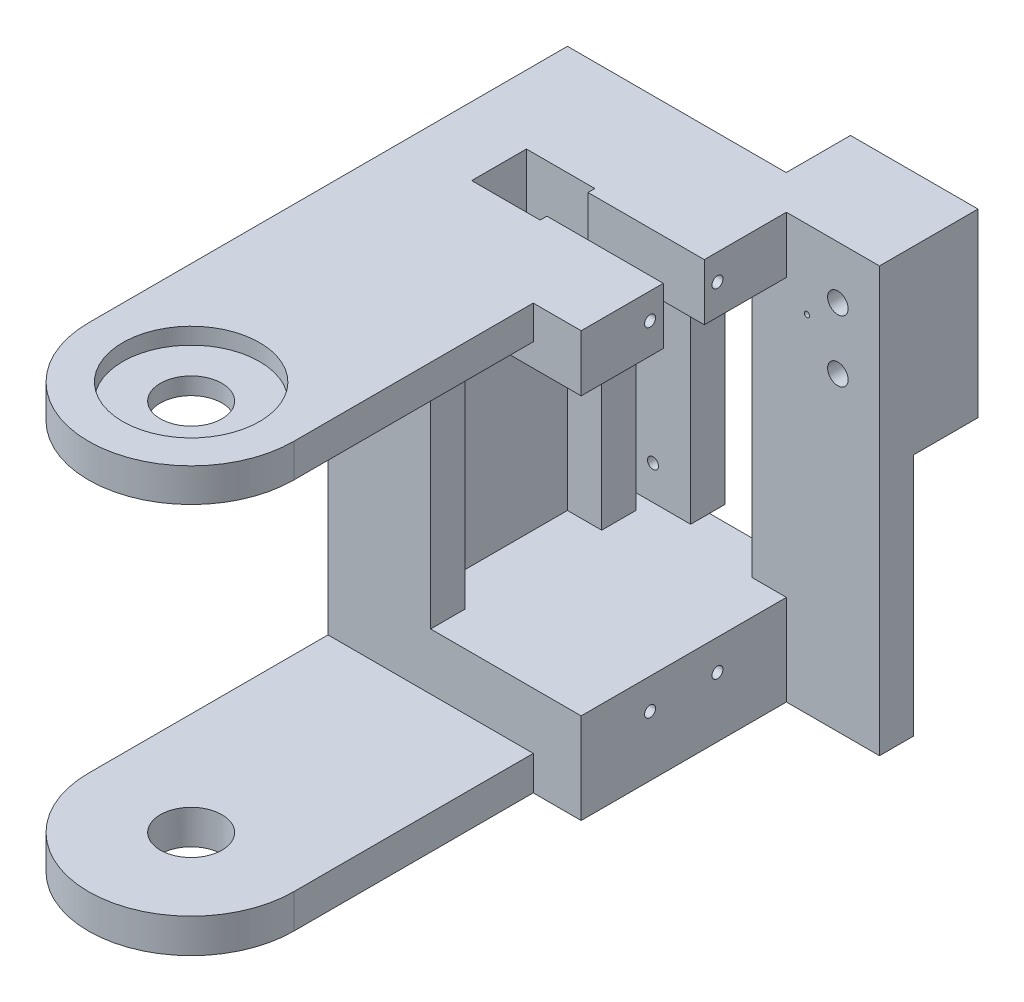
from build123d import *

# Parameters (mm, degrees)
ESQUISSE1_W                 = 60.5
ESQUISSE1_H                 = 64
BOSS_EXTRU_1_DEPTH          = 30
ESQUISSE2_R                 = 4.5
ENL_V_MAT_EXTRU_1_DEPTH     = 32
ENL_V_MAT_EXTRU_2_REACH     = 55.283
ESQUISSE4_W                 = 51.1
ESQUISSE4_H                 = 83.557669167
ESQUISSE5_R                 = 10.5
ENL_V_MAT_EXTRU_3_DEPTH     = 2
ESQUISSE6_R                 = 10
ENL_V_MAT_EXTRU_4_DEPTH     = 4.7
ESQUISSE7_W                 = 47
ESQUISSE7_H                 = 57
BOSS_EXTRU_2_DEPTH          = 30
ENL_V_MAT_EXTRU_5_DEPTH     = 30
ENL_V_MAT_EXTRU_6_DEPTH     = 8.25
ESQUISSE11_W                = 5
ESQUISSE11_H                = 40.5
BOSS_EXTRU_3_DEPTH          = 5
ESQUISSE12_R                = 0.5
ENL_V_MAT_EXTRU_7_DEPTH     = 15
TROU_TARAUD_M2X0_42_D       = 1.6
TROU_TARAUD_M2X0_42_DEPTH   = 17
TROU_TARAUD_M2X0_42_TIP     = 0.480688495
ENL_V_MAT_EXTRU_8_REACH     = 113.72
ESQUISSE22_W                = 82.97203866
ESQUISSE22_H                = 67.875780224
ENL_V_MAT_EXTRU_10_DEPTH    = 30
ESQUISSE23_W                = 55
ESQUISSE23_H                = 5
ESQUISSE23_H_2              = 4.9
BOSS_EXTRU_4_DEPTH          = 30
ENL_V_START                 = -62
ESQUISSE24_R                = 10
ENL_V_MAT_EXTRU_11_DEPTH    = 62
ENL_V_MAT_EXTRU_12_REACH    = 111.597
ESQUISSE26_R                = 10.5
ESQUISSE26_R_2              = 4.5
BOSS_EXTRU_5_DEPTH          = 5
ESQUISSE27_R                = 10.5
ENL_V_MAT_EXTRU_13_DEPTH    = 2.5
ESQUISSE28_W                = 21.53784572
ESQUISSE28_H                = 33.22443827
ENL_V_MAT_EXTRU_14_DEPTH    = 5
ESQUISSE29_W                = 5
ESQUISSE29_H                = 52.1
ENL_V_MAT_EXTRU_15_DEPTH    = 30
BOSS_EXTRU_6_DEPTH          = 62
ENL_V_START_2               = -20.388398
ESQUISSE32_W                = 38.789198293
ESQUISSE32_H                = 52.1
ENL_V_MAT_EXTRU_16_DEPTH    = 20.388398
ESQUISSE36_W                = 70.879809572
ESQUISSE36_H                = 44.299384872
ENL_V_MAT_EXTRU_20_DEPTH    = 62
ESQUISSE37_W                = 30
ESQUISSE37_H                = 4.9
ESQUISSE37_H_2              = 5
BOSS_EXTRU_8_DEPTH          = 50
ESQUISSE38_R                = 4.5
ENL_V_MAT_EXTRU_21_DEPTH    = 62
ESQUISSE39_R                = 10
ENL_V_MAT_EXTRU_22_DEPTH    = 4.9
ESQUISSE40_R                = 10.5
ENL_V_MAT_EXTRU_23_DEPTH    = 2.5
ENL_V_MAT_EXTRU_24_REACH    = 104.013
ESQUISSE44_W                = 30
ESQUISSE44_H                = 4.9
ESQUISSE44_H_2              = 5
BOSS_EXTRU_9_DEPTH          = 50
ENL_V_MAT_EXTRU_25_REACH    = 127.904
ESQUISSE45_R                = 4.5
ESQUISSE46_R                = 10
ENL_V_MAT_EXTRU_26_DEPTH    = 4.9
ESQUISSE47_R                = 10.5
ENL_V_MAT_EXTRU_27_DEPTH    = 2.5
ENL_V_MAT_EXTRU_28_DEPTH    = 62
ESQUISSE49_W                = 23
ESQUISSE49_H                = 31
BOSS_EXTRU_10_DEPTH         = 5
ESQUISSE50_R                = 0.45
ENL_V_MAT_EXTRU_29_DEPTH    = 5
TROU_TARAUD_M2X0_43_D       = 1.6
TROU_TARAUD_M2X0_43_DEPTH   = 10
TROU_TARAUD_M2X0_43_TIP     = 0.480688495
BOSS_EXTRU_11_DEPTH         = 5
ESQUISSE53_R                = 10.5
ESQUISSE53_R_2              = 4.5
BOSS_EXTRU_12_DEPTH         = 2.5
BOSS_EXTRU_14_START         = -2.5
ESQUISSE55_R                = 10
ESQUISSE55_R_2              = 4.5
BOSS_EXTRU_14_DEPTH         = 2.5
ESQUISSE56_R                = 0.3
ESQUISSE56_R_2              = 1.5
ENL_V_MAT_EXTRU_30_DEPTH    = 5
ESQUISSE58_W                = 13.11360463
ESQUISSE58_H                = 66.02814963
ENL_V_MAT_EXTRU_31_DEPTH    = 0.4
ESQUISSE59_W                = 19.635648438
ESQUISSE59_H                = 26.411381916
ESQUISSE59_R                = 0.3
ESQUISSE59_R_2              = 1.5
BOSS_EXTRU_15_DEPTH         = 9.4
TROU_TARAUD_M1_4X0_31_D     = 1.1
TROU_TARAUD_M1_4X0_31_DEPTH = 14.3
TROU_TARAUD_M1_4X0_31_TIP   = 0.33047334
ESQUISSE63_W                = 17.246623056
ESQUISSE63_H                = 70.264019857
ENL_V_MAT_EXTRU_32_DEPTH    = 1


with BuildPart() as part:
    # Esquisse1 → Boss.-Extru.1 (new body)
    with BuildSketch(Plane.XY):
        Rectangle(ESQUISSE1_W, ESQUISSE1_H)
    extrude(amount=BOSS_EXTRU_1_DEPTH)

    # Esquisse2 → Enlèv. mat.-Extru.1 (cut)
    with BuildSketch(Plane(origin=(30.25, 0, 0), x_dir=(0, 0, -1), z_dir=(1, 0, 0))):
        with Locations(Location((-15, -17, 0), (0, 0, 90))):
            Circle(ESQUISSE2_R)
    extrude(amount=-ENL_V_MAT_EXTRU_1_DEPTH, mode=Mode.SUBTRACT)

    # Enlèv. mat.-Extru.2: up to this face of the body (flat: up to its plane)
    enl_v_mat_extru_2_end = Plane(part.part.faces().sort_by_distance((0, 0, 0))[0])
    # Esquisse4 → Enlèv. mat.-Extru.2 (cut, up to the picked face)
    with BuildSketch(Plane.XY.offset(30), mode=Mode.PRIVATE) as enl_v_mat_extru_2_sk1:
        with Locations((0, -14.778834584)):
            Rectangle(ESQUISSE4_W, ESQUISSE4_H)
    enl_v_mat_extru_2_tool1 = split(extrude(enl_v_mat_extru_2_sk1.sketch, amount=-ENL_V_MAT_EXTRU_2_REACH, mode=Mode.PRIVATE), bisect_by=enl_v_mat_extru_2_end, keep=Keep.BOTH, mode=Mode.PRIVATE)
    add(enl_v_mat_extru_2_tool1.solids().sort_by(Axis((0, -14.778835, 30), (0, 0, -1)))[0], mode=Mode.SUBTRACT)

    # Esquisse5 → Enlèv. mat.-Extru.3 (cut)
    with BuildSketch(Plane(origin=(30.25, 0, 0), x_dir=(0, 0, -1), z_dir=(1, 0, 0))):
        with Locations(Location((-15, -17, 0), (0, 0, 90))):
            Circle(ESQUISSE5_R)
    extrude(amount=-ENL_V_MAT_EXTRU_3_DEPTH, mode=Mode.SUBTRACT)

    # Esquisse6 → Enlèv. mat.-Extru.4 (cut)
    with BuildSketch(Plane(origin=(-25.55, 0, 0), x_dir=(0, 0, -1), z_dir=(1, 0, 0))):
        with Locations((-15, -17)):
            Circle(ESQUISSE6_R)
    extrude(amount=-ENL_V_MAT_EXTRU_4_DEPTH, mode=Mode.SUBTRACT)

    # Esquisse7 → Boss.-Extru.2 (add)
    with BuildSketch(Plane.XY.offset(30)):
        with Locations((-6.75, 60.5)):
            Rectangle(ESQUISSE7_W, ESQUISSE7_H)
    extrude(amount=-BOSS_EXTRU_2_DEPTH)

    # Esquisse8 → Enlèv. mat.-Extru.5 (cut)
    with BuildSketch(Plane.XY.offset(30)):
        Polygon((-15.25, 80.75), (11.75, 80.75), (11.75, 101.149817475), (21.75, 101.149817475), (21.75, 32), (11.75, 32), (11.75, 40.25), (-15.25, 40.25), align=None)
    extrude(amount=-ENL_V_MAT_EXTRU_5_DEPTH, mode=Mode.SUBTRACT)

    # Esquisse10 → Enlèv. mat.-Extru.6 (cut)
    with BuildSketch(Plane.XZ.offset(-80.75)):
        Polygon((-5.25, 11), (-5.25, 12), (34.75, 12), (34.75, 18), (-5.25, 18), (-5.25, 19), (-15.25, 19), (-15.25, 11), align=None)
    extrude(amount=-ENL_V_MAT_EXTRU_6_DEPTH, mode=Mode.SUBTRACT)

    # Esquisse11 → Boss.-Extru.3 (add)
    with BuildSketch(Plane(origin=(-15.25, 0, 0), x_dir=(0, 0, -1), z_dir=(1, 0, 0))):
        with Locations((-27.5, 60.5)):
            Rectangle(ESQUISSE11_W, ESQUISSE11_H)
        with Locations((-2.5, 60.5)):
            Rectangle(ESQUISSE11_W, ESQUISSE11_H)
    extrude(amount=BOSS_EXTRU_3_DEPTH)

    # Esquisse12 → Enlèv. mat.-Extru.7 (cut)
    with BuildSketch(Plane(origin=(11.75, 0, 0), x_dir=(0, 0, -1), z_dir=(1, 0, 0))):
        with Locations((-19.925, 85.21)):
            Circle(ESQUISSE12_R)
        with Locations(Location((-10.075, 85.21, 0), (0, 0, 180))):
            Circle(ESQUISSE12_R)
        with Locations((-10.075, 35.79)):
            Circle(ESQUISSE12_R)
        with Locations(Location((-19.925, 35.79, 0), (0, 0, 180))):
            Circle(ESQUISSE12_R)
    extrude(amount=-ENL_V_MAT_EXTRU_7_DEPTH, mode=Mode.SUBTRACT)

    # Trou taraudé M2x0.42
    with Locations(Plane(origin=(11.75, 85.21, 19.925), x_dir=(0, 0, 1), z_dir=(1, 0, 0))):
        with Locations((0, 0), (-9.85, 0), (-9.85, 49.42), (0, 49.42)):
            Hole(TROU_TARAUD_M2X0_42_D / 2, depth=TROU_TARAUD_M2X0_42_DEPTH)
            with Locations((0, 0, -(TROU_TARAUD_M2X0_42_DEPTH + TROU_TARAUD_M2X0_42_TIP / 2))):  # 118° drill point
                Cone(0, TROU_TARAUD_M2X0_42_D / 2, TROU_TARAUD_M2X0_42_TIP, mode=Mode.SUBTRACT)

    # Enlèv. mat.-Extru.8: up to this face of the body (flat: up to its plane)
    enl_v_mat_extru_8_end = Plane(part.part.faces().sort_by_distance((30.25, 3.741727612, 15))[0])
    # Esquisse15 → Enlèv. mat.-Extru.8 (cut, up to the picked face)
    with BuildSketch(Plane.ZY.offset(30.25), mode=Mode.PRIVATE) as enl_v_mat_extru_8_sk1:
        with BuildLine():
            Line((40, -17), (30, -17))
            ThreePointArc((30, -17), (15, -32), (0, -17))
            Line((0, -17), (-10, -17))
            ThreePointArc((-10, -17), (15, -42), (40, -17))
        make_face()
    enl_v_mat_extru_8_tool1 = split(extrude(enl_v_mat_extru_8_sk1.sketch, amount=-ENL_V_MAT_EXTRU_8_REACH, mode=Mode.PRIVATE), bisect_by=enl_v_mat_extru_8_end, keep=Keep.BOTH, mode=Mode.PRIVATE)
    add(enl_v_mat_extru_8_tool1.solids().sort_by(Axis((-30.25, -17.559017, -5), (1, 0, 0)))[0], mode=Mode.SUBTRACT)

    # Esquisse22 → Enlèv. mat.-Extru.10 (cut)
    with BuildSketch(Plane.XY.offset(30)):
        with Locations((-1.917421061, -6.937890112)):
            Rectangle(ESQUISSE22_W, ESQUISSE22_H)
    extrude(amount=-ENL_V_MAT_EXTRU_10_DEPTH, mode=Mode.SUBTRACT)

    # Esquisse23 → Boss.-Extru.4 (add)
    with BuildSketch(Plane(origin=(0, 0, 0), x_dir=(-1, 0, 0), z_dir=(0, 0, -1))):
        with Locations((57.75, 29.5)):
            Rectangle(ESQUISSE23_W, ESQUISSE23_H)
        with Locations((57.75, 86.55)):
            Rectangle(ESQUISSE23_W, ESQUISSE23_H_2)
    extrude(amount=-BOSS_EXTRU_4_DEPTH)

    # Esquisse24 → Enlèv. mat.-Extru.11 (cut)
    with BuildSketch(Plane.XZ.offset(-27).offset(ENL_V_START)):
        with Locations((-74.25, 15)):
            Circle(ESQUISSE24_R)
    extrude(amount=ENL_V_MAT_EXTRU_11_DEPTH, mode=Mode.SUBTRACT)

    # Enlèv. mat.-Extru.12: up to this face of the body (flat: up to its plane)
    enl_v_mat_extru_12_end = Plane(part.part.faces().sort_by_distance((-34.437928466, 89, 15))[0])
    # Esquisse25 → Enlèv. mat.-Extru.12 (cut, up to the picked face)
    with BuildSketch(Plane.XZ.offset(-27), mode=Mode.PRIVATE) as enl_v_mat_extru_12_sk1:
        with BuildLine():
            Line((-74.25, 44.134833893), (-74.25, 30))
            ThreePointArc((-74.25, 30), (-89.25, 15), (-74.25, 0))
            Line((-74.25, 0), (-74.25, -14.134833893))
            ThreePointArc((-74.25, -14.134833893), (-103.384833893, 15), (-74.25, 44.134833893))
        make_face()
    enl_v_mat_extru_12_tool1 = split(extrude(enl_v_mat_extru_12_sk1.sketch, amount=-ENL_V_MAT_EXTRU_12_REACH, mode=Mode.PRIVATE), bisect_by=enl_v_mat_extru_12_end, keep=Keep.BOTH, mode=Mode.PRIVATE)
    add(enl_v_mat_extru_12_tool1.solids().sort_by(Axis((-74.901475, 27, 37.067417), (0, 1, 0)))[0], mode=Mode.SUBTRACT)

    # Esquisse26 → Boss.-Extru.5 (add)
    with BuildSketch(Plane.XZ.offset(-27)):
        with Locations((-74.25, 15)):
            Circle(ESQUISSE26_R)
        with Locations((-74.25, 15)):
            Circle(ESQUISSE26_R_2, mode=Mode.SUBTRACT)
    extrude(amount=-BOSS_EXTRU_5_DEPTH)

    # Esquisse27 → Enlèv. mat.-Extru.13 (cut)
    with BuildSketch(Plane.XZ.offset(-27)):
        with Locations((-74.25, 15)):
            Circle(ESQUISSE27_R)
    extrude(amount=-ENL_V_MAT_EXTRU_13_DEPTH, mode=Mode.SUBTRACT)

    # Esquisse28 → Enlèv. mat.-Extru.14 (cut)
    with BuildSketch(Plane(origin=(0, 32, 0), x_dir=(1, 0, 0), z_dir=(0, 1, 0))):
        with Locations((22.51892286, -16.612219135)):
            Rectangle(ESQUISSE28_W, ESQUISSE28_H)
    extrude(amount=-ENL_V_MAT_EXTRU_14_DEPTH, mode=Mode.SUBTRACT)

    # Esquisse29 → Enlèv. mat.-Extru.15 (cut)
    with BuildSketch(Plane(origin=(0, 0, 0), x_dir=(-1, 0, 0), z_dir=(0, 0, -1))):
        with Locations((27.75, 58.05)):
            Rectangle(ESQUISSE29_W, ESQUISSE29_H)
    extrude(amount=-ENL_V_MAT_EXTRU_15_DEPTH, mode=Mode.SUBTRACT)

    # Esquisse31 → Boss.-Extru.6 (add)
    with BuildSketch(Plane.XZ.offset(-27)):
        with BuildLine():
            ThreePointArc((-74.826036871, 4.515812787), (-83.84709586, 10.740217019), (-82.411654216, 21.605861069))
            Line((-82.411654216, 21.605861069), (-85.25, 25.198039027))
            Line((-85.25, 25.198039027), (-85.25, 4.801960973))
            Line((-85.25, 4.801960973), (-74.826036871, 4.515812787))
        make_face()
        with BuildLine():
            ThreePointArc((-85.25, 25.198039027), (-89.25, 15), (-85.25, 4.801960973))
            Line((-85.25, 4.801960973), (-85.25, 25.198039027))
        make_face()
    extrude(amount=-BOSS_EXTRU_6_DEPTH)

    # Esquisse32 → Enlèv. mat.-Extru.16 (cut)
    with BuildSketch(Plane(origin=(0.067526976, 0, 2.459909751), x_dir=(-0.9996234341769173, 0, 0.027440660421105302), z_dir=(-0.027440660421105302, 0, -0.9996234341769173)).offset(ENL_V_START_2)):
        with Locations((94.316375975, 58.05)):
            Rectangle(ESQUISSE32_W, ESQUISSE32_H)
    extrude(amount=ENL_V_MAT_EXTRU_16_DEPTH, mode=Mode.SUBTRACT)

    # Esquisse36 → Enlèv. mat.-Extru.20 (cut)
    with BuildSketch(Plane.XZ.offset(-27)):
        with Locations((-60.689904786, 17.333529037)):
            Rectangle(ESQUISSE36_W, ESQUISSE36_H)
    extrude(amount=-ENL_V_MAT_EXTRU_20_DEPTH, mode=Mode.SUBTRACT)

    # Esquisse37 → Boss.-Extru.8 (add)
    with BuildSketch(Plane.ZY.offset(25.25)):
        with Locations((15, 86.55)):
            Rectangle(ESQUISSE37_W, ESQUISSE37_H)
        with Locations((15, 29.5)):
            Rectangle(ESQUISSE37_W, ESQUISSE37_H_2)
    extrude(amount=BOSS_EXTRU_8_DEPTH)

    # Esquisse38 → Enlèv. mat.-Extru.21 (cut)
    with BuildSketch(Plane.XZ.offset(-27).offset(ENL_V_START)):
        with Locations((-59.885466485, 15)):
            Circle(ESQUISSE38_R)
    extrude(amount=ENL_V_MAT_EXTRU_21_DEPTH, mode=Mode.SUBTRACT)

    # Esquisse39 → Enlèv. mat.-Extru.22 (cut)
    with BuildSketch(Plane(origin=(0, 89, 0), x_dir=(1, 0, 0), z_dir=(0, 1, 0))):
        with Locations(Location((-59.885466485, -15, 0), (0, 0, 270))):
            Circle(ESQUISSE39_R)
    extrude(amount=-ENL_V_MAT_EXTRU_22_DEPTH, mode=Mode.SUBTRACT)

    # Esquisse40 → Enlèv. mat.-Extru.23 (cut)
    with BuildSketch(Plane.XZ.offset(-27)):
        with Locations((-59.885466485, 15)):
            Circle(ESQUISSE40_R)
    extrude(amount=-ENL_V_MAT_EXTRU_23_DEPTH, mode=Mode.SUBTRACT)

    # Enlèv. mat.-Extru.24: up to this face of the body (flat: up to its plane)
    enl_v_mat_extru_24_end = Plane(part.part.faces().sort_by_distance((-30.071057295, 89, 15))[0])
    # Esquisse42 → Enlèv. mat.-Extru.24 (cut, up to the picked face)
    with BuildSketch(Plane.XZ.offset(-27), mode=Mode.PRIVATE) as enl_v_mat_extru_24_sk1:
        with BuildLine():
            Line((-59.885466485, 38.922928663), (-59.885466485, 30))
            ThreePointArc((-59.885466485, 30), (-74.885466485, 15), (-59.885466485, 0))
            Line((-59.885466485, 0), (-59.885466485, -8.922928663))
            ThreePointArc((-59.885466485, -8.922928663), (-83.808395148, 15), (-59.885466485, 38.922928663))
        make_face()
    enl_v_mat_extru_24_tool1 = split(extrude(enl_v_mat_extru_24_sk1.sketch, amount=-ENL_V_MAT_EXTRU_24_REACH, mode=Mode.PRIVATE), bisect_by=enl_v_mat_extru_24_end, keep=Keep.BOTH, mode=Mode.PRIVATE)
    add(enl_v_mat_extru_24_tool1.solids().sort_by(Axis((-83.273462, 27, 15), (0, 1, 0)))[0], mode=Mode.SUBTRACT)

    # Esquisse44 → Boss.-Extru.9 (add)
    with BuildSketch(Plane.XY.offset(30)):
        with Locations((-10.25, 86.55)):
            Rectangle(ESQUISSE44_W, ESQUISSE44_H)
        with Locations((-10.25, 29.5)):
            Rectangle(ESQUISSE44_W, ESQUISSE44_H_2)
    extrude(amount=BOSS_EXTRU_9_DEPTH)

    # Enlèv. mat.-Extru.25: up to this face of the body (flat: up to its plane)
    enl_v_mat_extru_25_end = Plane(part.part.faces().sort_by_distance((-19.083390132, 27, 31.410783449))[0])
    # Esquisse45 → Enlèv. mat.-Extru.25 (cut, up to the picked face)
    with BuildSketch(Plane(origin=(0, 89, 0), x_dir=(1, 0, 0), z_dir=(0, 1, 0)), mode=Mode.PRIVATE) as enl_v_mat_extru_25_sk1:
        with Locations(Location((-10.25, -65, 0), (0, 0, 180))):
            Circle(ESQUISSE45_R)
    enl_v_mat_extru_25_tool1 = split(extrude(enl_v_mat_extru_25_sk1.sketch, amount=-ENL_V_MAT_EXTRU_25_REACH, mode=Mode.PRIVATE), bisect_by=enl_v_mat_extru_25_end, keep=Keep.BOTH, mode=Mode.PRIVATE)
    # Esquisse45 → Enlèv. mat.-Extru.25 (cut, up to the picked face)
    with BuildSketch(Plane(origin=(0, 89, 0), x_dir=(1, 0, 0), z_dir=(0, 1, 0)), mode=Mode.PRIVATE) as enl_v_mat_extru_25_sk2:
        with BuildLine():
            Line((-25.25, -65), (-36.206188562, -65))
            ThreePointArc((-36.206188562, -65), (-10.25, -90.956188562), (15.706188562, -65))
            Line((15.706188562, -65), (4.75, -65))
            ThreePointArc((4.75, -65), (-10.25, -80), (-25.25, -65))
        make_face()
    enl_v_mat_extru_25_tool2 = split(extrude(enl_v_mat_extru_25_sk2.sketch, amount=-ENL_V_MAT_EXTRU_25_REACH, mode=Mode.PRIVATE), bisect_by=enl_v_mat_extru_25_end, keep=Keep.BOTH, mode=Mode.PRIVATE)
    add(enl_v_mat_extru_25_tool1.solids().sort_by(Axis((-10.25, 89, 65), (0, -1, 0)))[0], mode=Mode.SUBTRACT)
    add(enl_v_mat_extru_25_tool2.solids().sort_by(Axis((-30.728094, 89, 65.580398), (0, -1, 0)))[0], mode=Mode.SUBTRACT)

    # Esquisse46 → Enlèv. mat.-Extru.26 (cut)
    with BuildSketch(Plane(origin=(0, 89, 0), x_dir=(1, 0, 0), z_dir=(0, 1, 0))):
        with Locations(Location((-10.25, -65, 0), (0, 0, 270))):
            Circle(ESQUISSE46_R)
    extrude(amount=-ENL_V_MAT_EXTRU_26_DEPTH, mode=Mode.SUBTRACT)

    # Esquisse47 → Enlèv. mat.-Extru.27 (cut)
    with BuildSketch(Plane.XZ.offset(-27)):
        with Locations((-10.25, 65)):
            Circle(ESQUISSE47_R)
    extrude(amount=-ENL_V_MAT_EXTRU_27_DEPTH, mode=Mode.SUBTRACT)

    # Esquisse48 → Enlèv. mat.-Extru.28 (cut)
    with BuildSketch(Plane(origin=(0, 89, 0), x_dir=(1, 0, 0), z_dir=(0, 1, 0))):
        Polygon((-25.25, 15), (-25.25, -37.588813894), (-103.224613984, -37.588813894), (-103.224613984, -30), (-103.224613984, 15), align=None)
    extrude(amount=-ENL_V_MAT_EXTRU_28_DEPTH, mode=Mode.SUBTRACT)

    # Esquisse49 → Boss.-Extru.10 (add)
    with BuildSketch(Plane(origin=(0, 0, 0), x_dir=(-1, 0, 0), z_dir=(0, 0, -1))):
        with Locations((13.75, 58)):
            Rectangle(ESQUISSE49_W, ESQUISSE49_H)
    extrude(amount=BOSS_EXTRU_10_DEPTH)

    # Esquisse50 → Enlèv. mat.-Extru.29 (cut)
    with BuildSketch(Plane(origin=(0, 0, -5), x_dir=(-1, 0, 0), z_dir=(0, 0, -1))):
        with Locations((7.75, 68.5)):
            Circle(ESQUISSE50_R)
        with Locations((7.75, 47.5)):
            Circle(ESQUISSE50_R)
        with Locations(Location((20.25, 68.5, 0), (0, 0, 180))):
            Circle(ESQUISSE50_R)
        with Locations(Location((20.25, 47.5, 0), (0, 0, 180))):
            Circle(ESQUISSE50_R)
    extrude(amount=-ENL_V_MAT_EXTRU_29_DEPTH, mode=Mode.SUBTRACT)

    # Trou taraudé M2x0.43
    with Locations(Plane(origin=(-7.75, 47.5, -5), x_dir=(-1, 0, 0), z_dir=(0, 0, -1))):
        with Locations((0, 0), (0, 21), (12.5, 21), (12.5, 0)):
            Hole(TROU_TARAUD_M2X0_43_D / 2, depth=TROU_TARAUD_M2X0_43_DEPTH)
            with Locations((0, 0, -(TROU_TARAUD_M2X0_43_DEPTH + TROU_TARAUD_M2X0_43_TIP / 2))):  # 118° drill point
                Cone(0, TROU_TARAUD_M2X0_43_D / 2, TROU_TARAUD_M2X0_43_TIP, mode=Mode.SUBTRACT)

    # Esquisse53 → Boss.-Extru.12 (add)
    with BuildSketch(Plane.XZ.offset(-27)):
        with Locations((-10.25, 65)):
            Circle(ESQUISSE53_R)
        with Locations((-10.25, 65)):
            Circle(ESQUISSE53_R_2, mode=Mode.SUBTRACT)
    extrude(amount=-BOSS_EXTRU_12_DEPTH)

    # Esquisse55 → Boss.-Extru.14 (add)
    with BuildSketch(Plane.XZ.offset(-84.1).offset(BOSS_EXTRU_14_START)):
        with Locations(Location((-10.25, 65, 0), (0, 0, 90))):
            Circle(ESQUISSE55_R)
        with Locations((-10.25, 65)):
            Circle(ESQUISSE55_R_2, mode=Mode.SUBTRACT)
    extrude(amount=BOSS_EXTRU_14_DEPTH)



with BuildPart() as body_2:
    # Esquisse52 → Boss.-Extru.11 (new body)
    with BuildSketch(Plane(origin=(0, 0, 0), x_dir=(-1, 0, 0), z_dir=(0, 0, -1))):
        Polygon((-11.75, 89), (-26.75, 89), (-26.75, 27), (-6.714351562, 27), (25.25, 27), (25.25, 40.25), (-6.714351562, 40.25), (-6.714351562, 80.75), (25.25, 80.75), (25.25, 89), (-6.714351562, 89), align=None)
    extrude(amount=BOSS_EXTRU_11_DEPTH)

    # Esquisse56 → Enlèv. mat.-Extru.30 (cut)
    with BuildSketch(Plane(origin=(0, 0, -5), x_dir=(-1, 0, 0), z_dir=(0, 0, -1))):
        with Locations((-14.75, 77.552)):
            Circle(ESQUISSE56_R)
        with Locations((-19.27, 81.292)):
            Circle(ESQUISSE56_R_2)
        with Locations((-19.27, 72.292)):
            Circle(ESQUISSE56_R_2)
    extrude(amount=-ENL_V_MAT_EXTRU_30_DEPTH, mode=Mode.SUBTRACT)

    # Esquisse58 → Enlèv. mat.-Extru.31 (cut)
    with BuildSketch(Plane(origin=(26.75, 0, 0), x_dir=(0, 0, -1), z_dir=(1, 0, 0))):
        with Locations((2.991130087, 58.460126478)):
            Rectangle(ESQUISSE58_W, ESQUISSE58_H)
    extrude(amount=-ENL_V_MAT_EXTRU_31_DEPTH, mode=Mode.SUBTRACT)


with BuildPart() as part_1:
    add(part.part)

    add(body_2.part)  # Boss.-Extru.15 merges body 2
    # Esquisse59 → Boss.-Extru.15 (add)
    with BuildSketch(Plane(origin=(0, 0, -5), x_dir=(-1, 0, 0), z_dir=(0, 0, -1))):
        with Locations((-16.532175781, 75.794309042)):
            Rectangle(ESQUISSE59_W, ESQUISSE59_H)
        with Locations((-14.75, 77.552)):
            Circle(ESQUISSE59_R, mode=Mode.SUBTRACT)
        with Locations((-19.27, 72.292)):
            Circle(ESQUISSE59_R_2, mode=Mode.SUBTRACT)
        with Locations((-19.27, 81.292)):
            Circle(ESQUISSE59_R_2, mode=Mode.SUBTRACT)
    extrude(amount=BOSS_EXTRU_15_DEPTH)

    # Trou taraudé M1.4x0.31
    with Locations(Plane(origin=(14.75, 77.552, -14.4), x_dir=(-1, 0, 0), z_dir=(0, 0, -1))):
        with Locations((0, 0)):
            Hole(TROU_TARAUD_M1_4X0_31_D / 2, depth=TROU_TARAUD_M1_4X0_31_DEPTH)
            with Locations((0, 0, -(TROU_TARAUD_M1_4X0_31_DEPTH + TROU_TARAUD_M1_4X0_31_TIP / 2))):  # 118° drill point
                Cone(0, TROU_TARAUD_M1_4X0_31_D / 2, TROU_TARAUD_M1_4X0_31_TIP, mode=Mode.SUBTRACT)

    # Esquisse63 → Enlèv. mat.-Extru.32 (cut)
    with BuildSketch(Plane(origin=(26.35, 0, 0), x_dir=(0, 0, -1), z_dir=(1, 0, 0))):
        with Locations((7.122738555, 58.255505527)):
            Rectangle(ESQUISSE63_W, ESQUISSE63_H)
    extrude(amount=-ENL_V_MAT_EXTRU_32_DEPTH, mode=Mode.SUBTRACT)


solid = part_1.part
